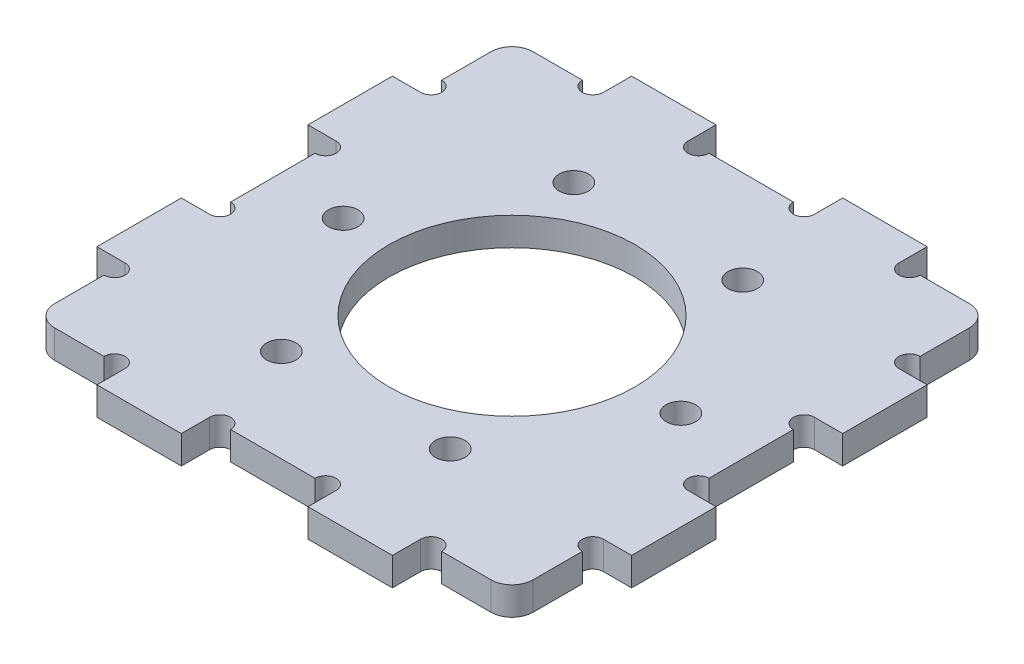
from build123d import *

# Parameters (mm, degrees)
SKETCH_1_W          = 68
SKETCH_1_H          = 68
SKETCH_1_R          = 17.5
EXTRUDE_1_DEPTH     = 4
SKETCH_2_W          = 12
SKETCH_2_H          = 4
SKETCH_2_W_2        = 4
SKETCH_2_H_2        = 12
EXTRUDE_2_DEPTH     = 4
SKETCH_3_R          = 1.5
CUT_EXTRUDE_1_DEPTH = 4
FILLET_1_R          = 3
SKETCH_4_R          = 2.1
CUT_EXTRUDE_2_DEPTH = 10


with BuildPart() as part:
    # 草图1 → 凸台-拉伸1 (new body)
    with BuildSketch(Plane(origin=(0, 0, 0), x_dir=(1, 0, 0), z_dir=(0, 1, 0))):
        Rectangle(SKETCH_1_W, SKETCH_1_H)
        with Locations(Location((0, 0, 0), (0, 0, 270))):
            Circle(SKETCH_1_R, mode=Mode.SUBTRACT)
    extrude(amount=EXTRUDE_1_DEPTH)

    # 草图2 → 凸台-拉伸2 (add)
    with BuildSketch(Plane(origin=(0, 4, 0), x_dir=(1, 0, 0), z_dir=(0, 1, 0))):
        with Locations((-15, 36)):
            Rectangle(SKETCH_2_W, SKETCH_2_H)
        with Locations((15, 36)):
            Rectangle(SKETCH_2_W, SKETCH_2_H)
        with Locations((36, 15)):
            Rectangle(SKETCH_2_W_2, SKETCH_2_H_2)
        with Locations((36, -15)):
            Rectangle(SKETCH_2_W_2, SKETCH_2_H_2)
        with Locations((15, -36)):
            Rectangle(SKETCH_2_W, SKETCH_2_H)
        with Locations((-15, -36)):
            Rectangle(SKETCH_2_W, SKETCH_2_H)
        with Locations((-36, -15)):
            Rectangle(SKETCH_2_W_2, SKETCH_2_H_2)
        with Locations((-36, 15)):
            Rectangle(SKETCH_2_W_2, SKETCH_2_H_2)
    extrude(amount=-EXTRUDE_2_DEPTH)

    # 草图3 → 切除-拉伸1 (cut)
    with BuildSketch(Plane(origin=(0, 4, 0), x_dir=(1, 0, 0), z_dir=(0, 1, 0))):
        with Locations((-22.5, 34)):
            Circle(SKETCH_3_R)
        with Locations((-7.5, 34)):
            Circle(SKETCH_3_R)
        with Locations((7.5, 34)):
            Circle(SKETCH_3_R)
        with Locations((22.5, 34)):
            Circle(SKETCH_3_R)
        with Locations((34, 22.5)):
            Circle(SKETCH_3_R)
        with Locations((34, 7.5)):
            Circle(SKETCH_3_R)
        with Locations((34, -7.5)):
            Circle(SKETCH_3_R)
        with Locations((34, -22.5)):
            Circle(SKETCH_3_R)
        with Locations((22.5, -34)):
            Circle(SKETCH_3_R)
        with Locations((7.5, -34)):
            Circle(SKETCH_3_R)
        with Locations((-7.5, -34)):
            Circle(SKETCH_3_R)
        with Locations((-22.5, -34)):
            Circle(SKETCH_3_R)
        with Locations((-34, -22.5)):
            Circle(SKETCH_3_R)
        with Locations((-34, -7.5)):
            Circle(SKETCH_3_R)
        with Locations((-34, 7.5)):
            Circle(SKETCH_3_R)
        with Locations((-34, 22.5)):
            Circle(SKETCH_3_R)
    extrude(amount=-CUT_EXTRUDE_1_DEPTH, mode=Mode.SUBTRACT)

    # 圆角1
    fillet_1_edges = [part.edges().sort_by_distance(p)[0] for p in [
        (34, 2, 34),
        (-34, 2, 34),
        (-34, 2, -34),
        (34, 2, -34),
    ]]
    fillet(fillet_1_edges, radius=FILLET_1_R)

    # 草图4 → 切除-拉伸2 (cut)
    with BuildSketch(Plane(origin=(0, 4, 0), x_dir=(1, 0, 0), z_dir=(0, 1, 0))):
        with Locations(Location((24, 0, 0), (0, 0, 270))):
            Circle(SKETCH_4_R)
        with Locations(Location((12, -20.784609691, 0), (0, 0, 270))):
            Circle(SKETCH_4_R)
        with Locations(Location((-12, -20.784609691, 0), (0, 0, 270))):
            Circle(SKETCH_4_R)
        with Locations(Location((-24, 0, 0), (0, 0, 270))):
            Circle(SKETCH_4_R)
        with Locations(Location((-12, 20.784609691, 0), (0, 0, 270))):
            Circle(SKETCH_4_R)
        with Locations(Location((12, 20.784609691, 0), (0, 0, 270))):
            Circle(SKETCH_4_R)
    extrude(amount=-CUT_EXTRUDE_2_DEPTH, mode=Mode.SUBTRACT)


solid = part.part
